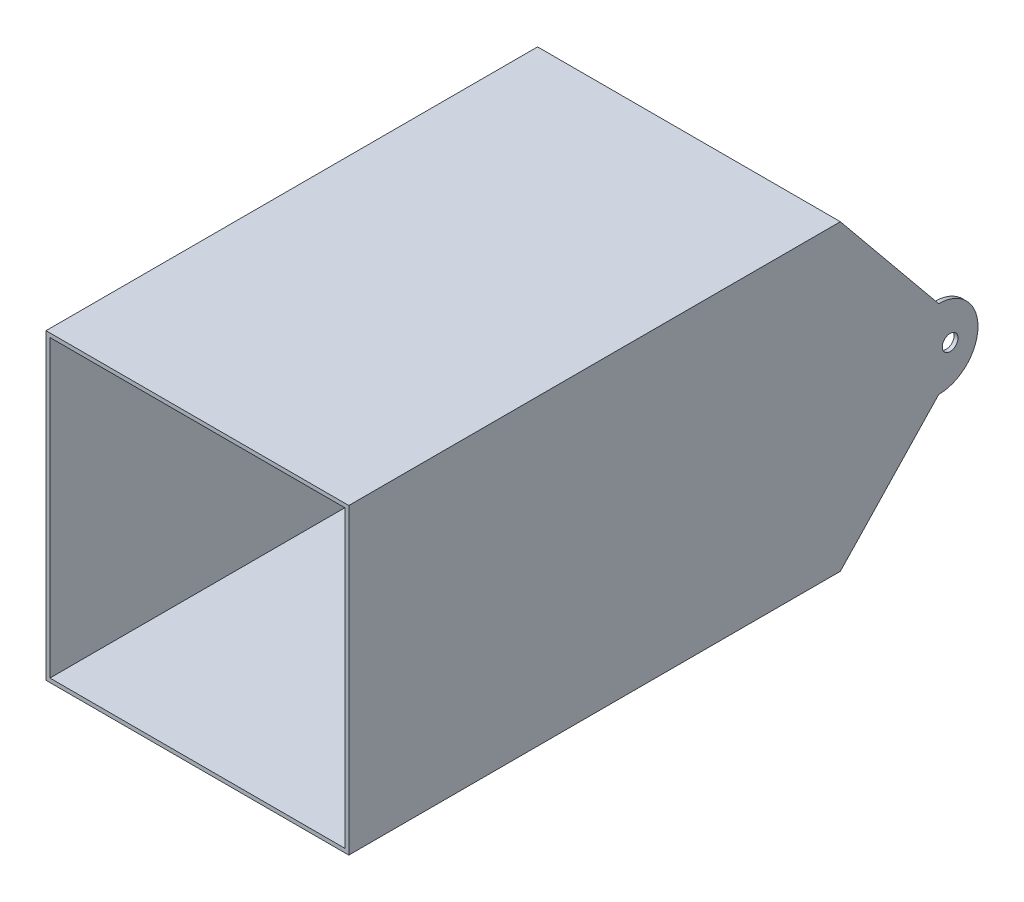
from build123d import *

# Parameters (mm, degrees)
SKETCH1_W               = 154
SKETCH1_H               = 154
SKETCH1_W_2             = 150
SKETCH1_H_2             = 150
BOSS_EXTRUDE1_DEPTH     = 250
BOSS_EXTRUDE6_DEPTH     = 2
BOSS_EXTRUDE7_START     = -152
BOSS_EXTRUDE7_DEPTH     = 2
CUT_EXTRUDE1_DEPTH      = 304.553949235
CUT_EXTRUDE1_DEPTH_BACK = 304.553949235
SKETCH8_R               = 4


with BuildPart() as part:
    # Sketch1 → Boss-Extrude1 (new body)
    with BuildSketch(Plane.XY):
        Rectangle(SKETCH1_W, SKETCH1_H)
        Rectangle(SKETCH1_W_2, SKETCH1_H_2, mode=Mode.SUBTRACT)
    extrude(amount=BOSS_EXTRUDE1_DEPTH)

    # Sketch3 → Loft1 section 0
    with BuildSketch(Plane.XY.offset(-50)):
        with BuildLine():
            Line((-77, 15.887313735), (77, 15.887313735))
            Line((77, 15.887313735), (77, -24.112686265))
            Line((77, -24.112686265), (-77, -24.112686265))
            Line((-77, -24.112686265), (-77, 15.887313735))
        make_face()
    # Sketch2 → Loft1 section 1
    with BuildSketch(Plane(origin=(0, 0, 0), x_dir=(-1, 0, 0), z_dir=(0, 0, -1))):
        with BuildLine():
            Line((-77, 77), (77, 77))
            Line((77, 77), (77, -77))
            Line((77, -77), (-77, -77))
            Line((-77, -77), (-77, 77))
        make_face()
    loft()

    # Sketch3<3> → Cut-Loft1 section 0
    with BuildSketch(Plane.XY.offset(-50)):
        with BuildLine():
            Line((-75, 13.887313735), (-75, -22.112686265))
            Line((-75, -22.112686265), (75, -22.112686265))
            Line((75, -22.112686265), (75, 13.887313735))
            Line((75, 13.887313735), (-75, 13.887313735))
        make_face()
    # Sketch1<2> → Cut-Loft1 section 1
    with BuildSketch(Plane.XY):
        with BuildLine():
            Line((-75, 75), (75, 75))
            Line((75, 75), (75, -75))
            Line((75, -75), (-75, -75))
            Line((-75, -75), (-75, 75))
        make_face()
    loft(mode=Mode.SUBTRACT)

    # Sketch7 → Boss-Extrude6 (add)
    with BuildSketch(Plane(origin=(77, 0, 0), x_dir=(0, 0, -1), z_dir=(1, 0, 0))):
        with BuildLine():
            Line((50, 15.887313735), (50, -24.112686265))
            ThreePointArc((50, -24.112686265), (70, -4.112686265), (50, 15.887313735))
        make_face()
    extrude(amount=-BOSS_EXTRUDE6_DEPTH)

    # Sketch7<2> → Boss-Extrude7 (add)
    with BuildSketch(Plane(origin=(77, 0, 0), x_dir=(0, 0, -1), z_dir=(1, 0, 0)).offset(BOSS_EXTRUDE7_START)):
        with BuildLine():
            Line((50, 15.887313735), (50, -24.112686265))
            ThreePointArc((50, -24.112686265), (70, -4.112686265), (50, 15.887313735))
        make_face()
    extrude(amount=-BOSS_EXTRUDE7_DEPTH)

    # Sketch8 → Cut-Extrude1 (cut, two sides: drawn at the far end of the back side and taken through both)
    with BuildSketch(Plane(origin=(77, 0, 0), x_dir=(0, 0, -1), z_dir=(1, 0, 0)).offset(-CUT_EXTRUDE1_DEPTH_BACK)):
        with Locations(Location((55.834353072, -4.112686265, 0), (0, 0, 90))):
            Circle(SKETCH8_R)
    extrude(amount=CUT_EXTRUDE1_DEPTH + CUT_EXTRUDE1_DEPTH_BACK, mode=Mode.SUBTRACT)


solid = part.part
